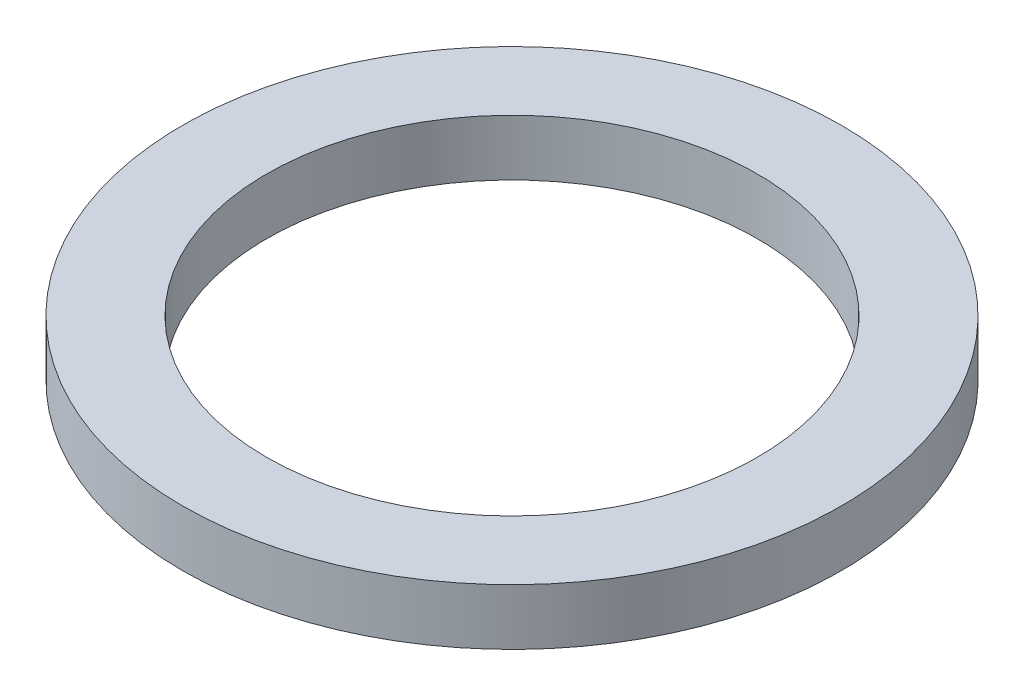
from build123d import *

# Parameters (mm, degrees)
SKETCH_1_R        = 23.5
SKETCH_1_R_2      = 17.5
EXTRUDE_303_DEPTH = 4


with BuildPart() as part:
    # Эскиз1 → Extrude 303 (new body)
    with BuildSketch(Plane(origin=(0, 0, 0), x_dir=(1, 0, 0), z_dir=(0, 1, 0))):
        with Locations(Location((0, 0, 0), (0, 0, 270))):
            Circle(SKETCH_1_R)
        with Locations(Location((0, 0, 0), (0, 0, 270))):
            Circle(SKETCH_1_R_2, mode=Mode.SUBTRACT)
    extrude(amount=EXTRUDE_303_DEPTH)


solid = part.part
